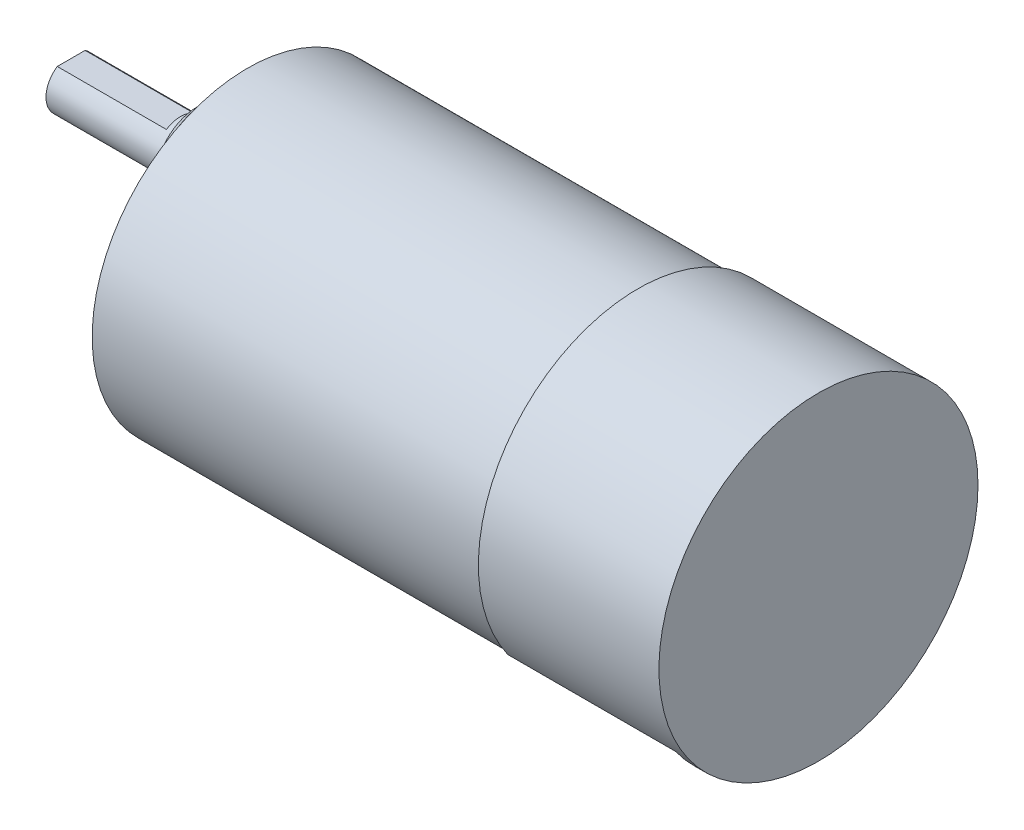
from build123d import *

# Parameters (mm, degrees)
SKETCH2_R           = 18.5
BOSS_EXTRUDE1_DEPTH = 50
SKETCH3_R           = 6
BOSS_EXTRUDE2_DEPTH = 6
SKETCH4_R           = 3
BOSS_EXTRUDE3_DEPTH = 15
CHAMFER1_SIZE       = 1
CUT_EXTRUDE1_DEPTH  = 13
SKETCH6_R           = 6
CUT_EXTRUDE2_DEPTH  = 0.5
CUT_EXTRUDE3_START  = -3.5
SKETCH7_R           = 18.5
CUT_EXTRUDE3_DEPTH  = 3.5
SKETCH8_R           = 19
BOSS_EXTRUDE4_DEPTH = 21.5
SKETCH9_W           = 20
SKETCH9_H           = 31
CUT_EXTRUDE4_DEPTH  = 21.5


with BuildPart() as part:
    # Sketch2 → Boss-Extrude1 (new body)
    with BuildSketch(Plane(origin=(0, 0, 0), x_dir=(0, 0, -1), z_dir=(1, 0, 0))):
        Circle(SKETCH2_R)
    extrude(amount=BOSS_EXTRUDE1_DEPTH)

    # Sketch6 → Cut-Extrude2 (cut)
    with BuildSketch(Plane.ZY):
        with Locations((0, 6.5)):
            Circle(SKETCH6_R)
        with BuildLine():
            ThreePointArc((-8.634593969, 9.038461538), (0, -12.5), (8.634593969, 9.038461538))
            ThreePointArc((8.634593969, 9.038461538), (0, -2.5), (-8.634593969, 9.038461538))
        make_face()
    extrude(amount=-CUT_EXTRUDE2_DEPTH, mode=Mode.SUBTRACT)

    # Sketch7 → Cut-Extrude3 (cut)
    with BuildSketch(Plane(origin=(50, 0, 0), x_dir=(0, 0, -1), z_dir=(1, 0, 0)).offset(CUT_EXTRUDE3_START)):
        Circle(SKETCH7_R)
    extrude(amount=CUT_EXTRUDE3_DEPTH, mode=Mode.SUBTRACT)


with BuildPart() as body_2:
    # Sketch3 → Boss-Extrude2 (new body)
    with BuildSketch(Plane.ZY):
        with Locations((0, 6.5)):
            Circle(SKETCH3_R)
    extrude(amount=BOSS_EXTRUDE2_DEPTH)

    # Chamfer1
    chamfer1_edges = [body_2.edges().sort_by_distance(p)[0] for p in [
        (-6, 6.5, -6),
    ]]
    chamfer(chamfer1_edges, length=CHAMFER1_SIZE)


with BuildPart() as body_3:
    # Sketch4 → Boss-Extrude3 (new body)
    with BuildSketch(Plane.ZY.offset(6)):
        with Locations((0, 6.5)):
            Circle(SKETCH4_R)
    extrude(amount=BOSS_EXTRUDE3_DEPTH)

    # Sketch5 → Cut-Extrude1 (cut)
    with BuildSketch(Plane.ZY.offset(21)):
        with BuildLine():
            Line((1.658312395, 9), (-1.658312395, 9))
            ThreePointArc((-1.658312395, 9), (0, 9.5), (1.658312395, 9))
        make_face()
    extrude(amount=-CUT_EXTRUDE1_DEPTH, mode=Mode.SUBTRACT)


with BuildPart() as body_4:
    # Sketch8 → Boss-Extrude4 (new body)
    with BuildSketch(Plane(origin=(46.5, 0, 0), x_dir=(0, 0, -1), z_dir=(1, 0, 0))):
        Circle(SKETCH8_R)
    extrude(amount=BOSS_EXTRUDE4_DEPTH)

    # Sketch9 → Cut-Extrude4 (cut)
    with BuildSketch(Plane(origin=(0, 0, 0), x_dir=(1, 0, 0), z_dir=(0, 1, 0))):
        with Locations((56.5, 0)):
            Rectangle(SKETCH9_W, SKETCH9_H)
    extrude(amount=-CUT_EXTRUDE4_DEPTH, mode=Mode.SUBTRACT)


solid = Compound([part.part, body_2.part, body_3.part, body_4.part])
